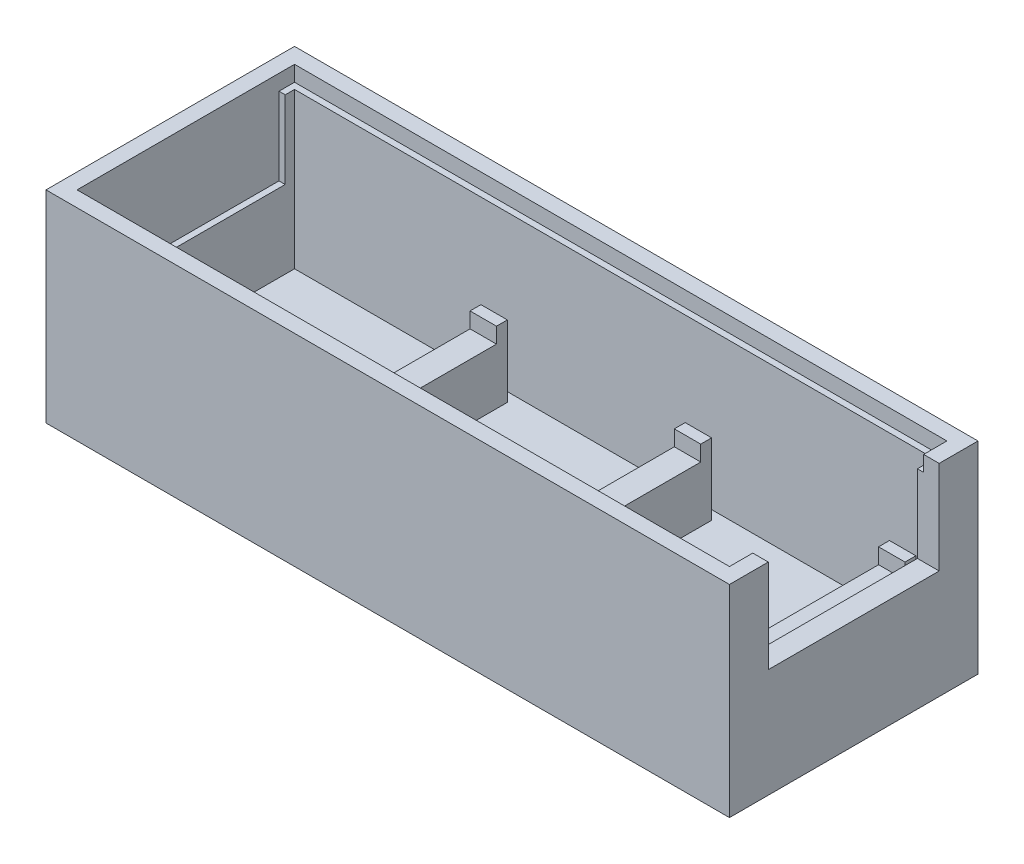
from build123d import *

# Parameters (mm, degrees)
SKETCH_1_W                                 = 44
SKETCH_1_H                                 = 16
EXTRUDE_1_DEPTH                            = 2
SKETCH_2_W                                 = 44
SKETCH_2_H                                 = 16
SKETCH_2_W_2                               = 40
SKETCH_2_H_2                               = 12
EXTRUDE_2_DEPTH                            = 10
SKETCH_3_W                                 = 5.5
SKETCH_3_H                                 = 4
CUT_EXTRUDE_1_DEPTH                        = 2
SKETCH_4_W                                 = 1.7
SKETCH_4_H                                 = 12
EXTRUDE_4_DEPTH                            = 4.6
SKETCH_9_W                                 = 44
SKETCH_9_H                                 = 16
SKETCH_9_W_2                               = 42
SKETCH_9_H_2                               = 14
EXTRUDE_5_DEPTH                            = 1
SKETCH_12_W                                = 1
SKETCH_12_H                                = 12
CUT_EXTRUDE_3_DEPTH                        = 5
SKETCH_13_W                                = 41.2
SKETCH_13_H                                = 13.2
SKETCH_13_W_2                              = 40
SKETCH_13_H_2                              = 12
REVB_ASSEMBLYCLEARANCE_41P2X13P2_DEPTH     = 11
SKETCH_14_W                                = 11
SKETCH_14_H                                = 7
REVB_USB_TOPLOADING_USLOT_DEPTH            = 2.1
SKETCH_17_W                                = 10.6
SKETCH_17_H                                = 1.01
REVB_UNDERSIDESOLDERRELIEF_1MM_DEPTH       = 28
REVB_DEFAULTORIENTATION_OPENINGPLUSY_ANGLE = 180


with BuildPart() as part:
    # 草图1 → 凸台-拉伸1 (new body)
    with BuildSketch(Plane(origin=(0, 0, 0), x_dir=(1, 0, 0), z_dir=(0, 1, 0))):
        Rectangle(SKETCH_1_W, SKETCH_1_H)
    extrude(amount=-EXTRUDE_1_DEPTH)

    # 草图2 → 凸台-拉伸2 (add)
    with BuildSketch(Plane.XZ.offset(2)):
        Rectangle(SKETCH_2_W, SKETCH_2_H)
        Rectangle(SKETCH_2_W_2, SKETCH_2_H_2, mode=Mode.SUBTRACT)
    extrude(amount=EXTRUDE_2_DEPTH)

    # 草图3 → 切除-拉伸1 (cut)
    with BuildSketch(Plane.ZY.offset(22)):
        with Locations((2.75, -9)):
            Rectangle(SKETCH_3_W, SKETCH_3_H)
        with Locations((-2.75, -9)):
            Rectangle(SKETCH_3_W, SKETCH_3_H)
    extrude(amount=-CUT_EXTRUDE_1_DEPTH, mode=Mode.SUBTRACT)

    # 草图4 → 凸台-拉伸4 (add)
    with BuildSketch(Plane.XZ.offset(2)):
        with Locations((7.15, 0)):
            Rectangle(SKETCH_4_W, SKETCH_4_H)
        with Locations((-19.15, 0)):
            Rectangle(SKETCH_4_W, SKETCH_4_H)
        with Locations((-6, 0)):
            Rectangle(SKETCH_4_W, SKETCH_4_H)
    extrude(amount=EXTRUDE_4_DEPTH)

    # 草图9 → 凸台-拉伸5 (add)
    with BuildSketch(Plane.XZ.offset(12)):
        Rectangle(SKETCH_9_W, SKETCH_9_H)
        Rectangle(SKETCH_9_W_2, SKETCH_9_H_2, mode=Mode.SUBTRACT)
    extrude(amount=EXTRUDE_5_DEPTH)

    # 草图12 → 切除-拉伸3 (cut)
    with BuildSketch(Plane.XZ.offset(12)):
        with Locations((20.5, 0)):
            Rectangle(SKETCH_12_W, SKETCH_12_H)
    extrude(amount=-CUT_EXTRUDE_3_DEPTH, mode=Mode.SUBTRACT)

    # 草图13 → RevB_AssemblyClearance_41p2x13p2 (cut)
    with BuildSketch(Plane.XZ.offset(13)):
        Rectangle(SKETCH_13_W, SKETCH_13_H)
        Rectangle(SKETCH_13_W_2, SKETCH_13_H_2, mode=Mode.SUBTRACT)
    extrude(amount=-REVB_ASSEMBLYCLEARANCE_41P2X13P2_DEPTH, mode=Mode.SUBTRACT)

    # 草图14 → RevB_USB_TopLoading_Uslot (cut)
    with BuildSketch(Plane.ZY.offset(22)):
        with Locations((0, -10.5)):
            Rectangle(SKETCH_14_W, SKETCH_14_H)
    extrude(amount=-REVB_USB_TOPLOADING_USLOT_DEPTH, mode=Mode.SUBTRACT)

    # 草图17 → RevB_UndersideSolderRelief_1mm (cut)
    with BuildSketch(Plane(origin=(8, 0, 0), x_dir=(0, 0, -1), z_dir=(1, 0, 0))):
        with Locations((0, -6.105)):
            Rectangle(SKETCH_17_W, SKETCH_17_H)
    extrude(amount=-REVB_UNDERSIDESOLDERRELIEF_1MM_DEPTH, mode=Mode.SUBTRACT)


with BuildPart() as part_1:
    # RevB_DefaultOrientation_OpeningPlusY: moved
    add(part.part.rotate(Axis((0, 0, 0), (0, 0, 1)), REVB_DEFAULTORIENTATION_OPENINGPLUSY_ANGLE))


solid = part_1.part
